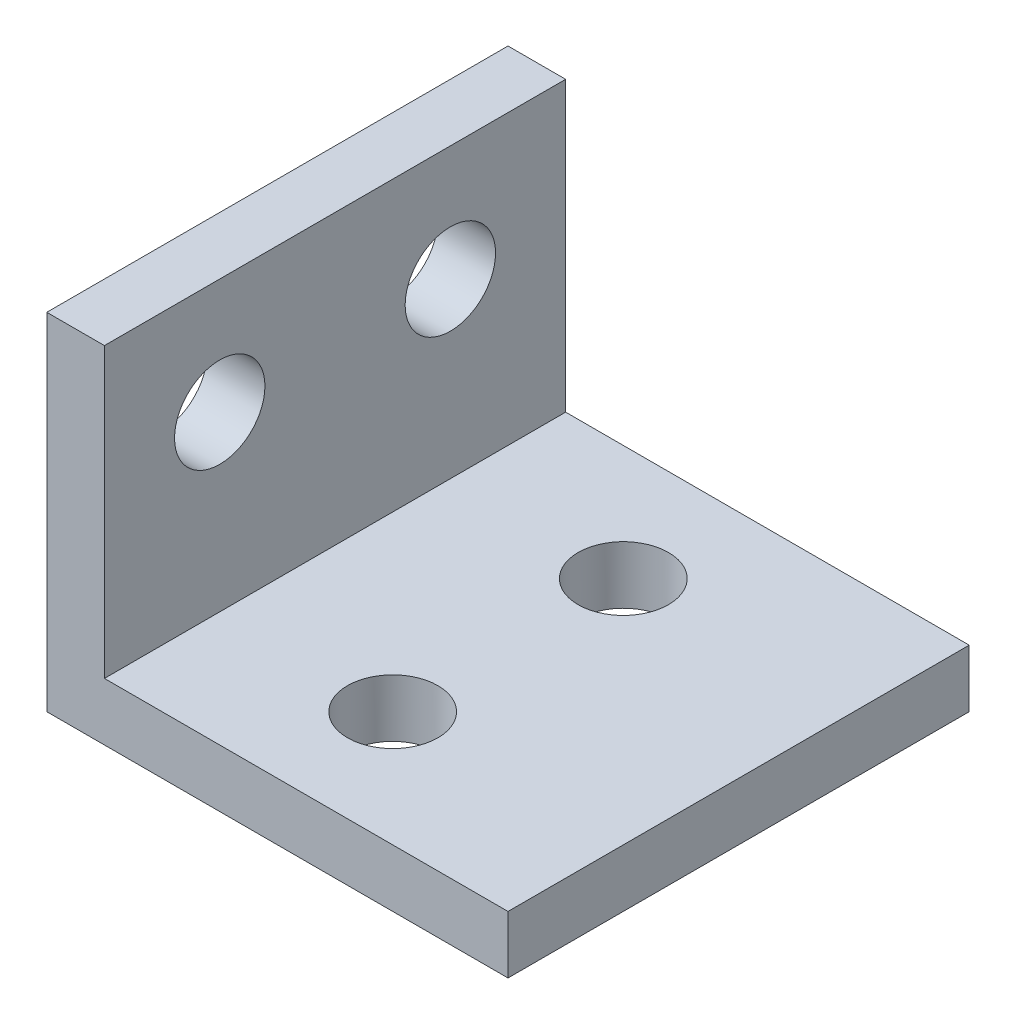
from build123d import *

# Parameters (mm, degrees)
BOSS_EXTRUDE1_DEPTH     = 12.7
CUT_EXTRUDE1_DEPTH      = 33.534068682
CUT_EXTRUDE1_DEPTH_BACK = 33.534068682
SKETCH3_R               = 2.4892
CUT_EXTRUDE2_DEPTH      = 32.908355097
CUT_EXTRUDE2_DEPTH_BACK = 32.908355097
SKETCH4_R               = 2.4892


with BuildPart() as part:
    # Sketch1 → Boss-Extrude1 (new, symmetric)
    with BuildSketch(Plane.XY):
        Polygon((0, 0), (0, 19.05), (3.175, 19.05), (3.175, 3.175), (25.4, 3.175), (25.4, 0), align=None)
    extrude(amount=BOSS_EXTRUDE1_DEPTH, both=True)

    # Sketch3 → Cut-Extrude1 (cut, two sides: drawn at the far end of the back side and taken through both)
    with BuildSketch(Plane(origin=(0, 3.175, 0), x_dir=(1, 0, 0), z_dir=(0, 1, 0)).offset(-CUT_EXTRUDE1_DEPTH_BACK)):
        with Locations(Location((12.7, -6.35, 0), (0, 0, 270))):
            Circle(SKETCH3_R)
        with Locations(Location((12.7, 6.35, 0), (0, 0, 270))):
            Circle(SKETCH3_R)
    extrude(amount=CUT_EXTRUDE1_DEPTH + CUT_EXTRUDE1_DEPTH_BACK, mode=Mode.SUBTRACT)

    # Sketch4 → Cut-Extrude2 (cut, two sides: drawn at the far end of the back side and taken through both)
    with BuildSketch(Plane(origin=(3.175, 0, 0), x_dir=(0, 0, -1), z_dir=(1, 0, 0)).offset(-CUT_EXTRUDE2_DEPTH_BACK)):
        with Locations(Location((-6.35, 12.7, 0), (0, 0, 90))):
            Circle(SKETCH4_R)
        with Locations(Location((6.35, 12.7, 0), (0, 0, 90))):
            Circle(SKETCH4_R)
    extrude(amount=CUT_EXTRUDE2_DEPTH + CUT_EXTRUDE2_DEPTH_BACK, mode=Mode.SUBTRACT)


solid = part.part
